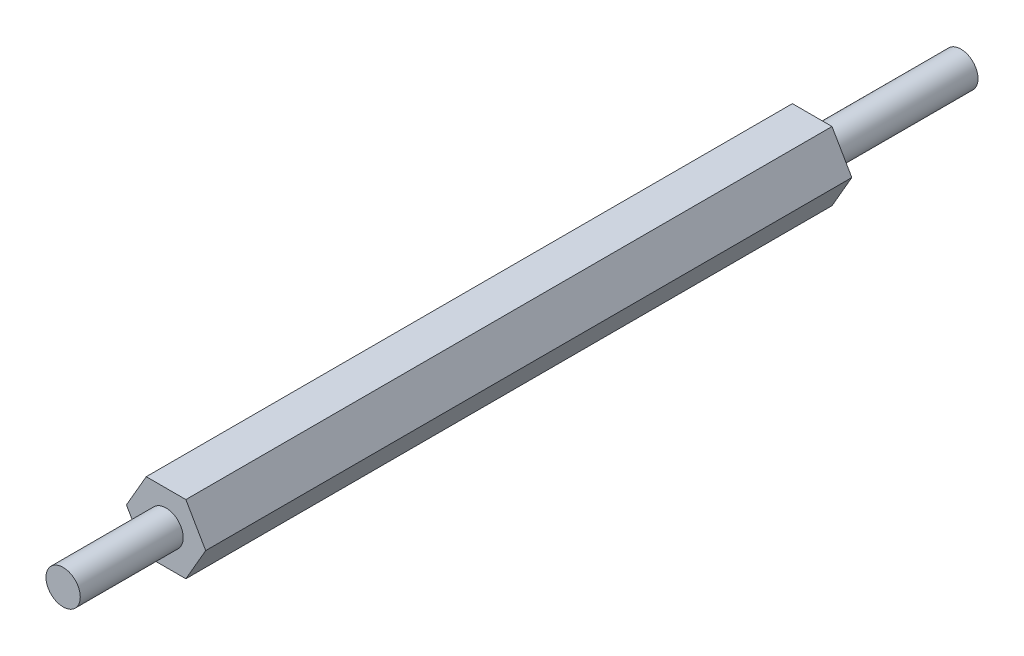
from build123d import *

# Parameters (mm, degrees)
EXTRUDE_56_5_DEPTH  = 56.5
EXTRUDE_START       = -13
SKETCH_2_R          = 1.5
EXTRUDE_M3_13_DEPTH = 13
EXTRUDE_START_2     = 56.5
SKETCH_3_R          = 1.5
EXTRUDE_M3_9_DEPTH  = 9


with BuildPart() as part:
    # 草图1 → 六角柱_有效长56.5 (new body)
    with BuildSketch(Plane.XY):
        Polygon((3.464101615, 0), (1.732050808, 3), (-1.732050808, 3), (-3.464101615, 0), (-1.732050808, -3), (1.732050808, -3), align=None)
    extrude(amount=EXTRUDE_56_5_DEPTH)

    # 草图2 → 下端M3公头_长13 (add)
    with BuildSketch(Plane.XY.offset(EXTRUDE_START)):
        with Locations(Location((0, 0, 0), (0, 0, 180))):
            Circle(SKETCH_2_R)
    extrude(amount=EXTRUDE_M3_13_DEPTH)

    # 草图3 → 上端M3公头_长9 (add)
    with BuildSketch(Plane.XY.offset(EXTRUDE_START_2)):
        with Locations(Location((0, 0, 0), (0, 0, 180))):
            Circle(SKETCH_3_R)
    extrude(amount=EXTRUDE_M3_9_DEPTH)


solid = part.part
